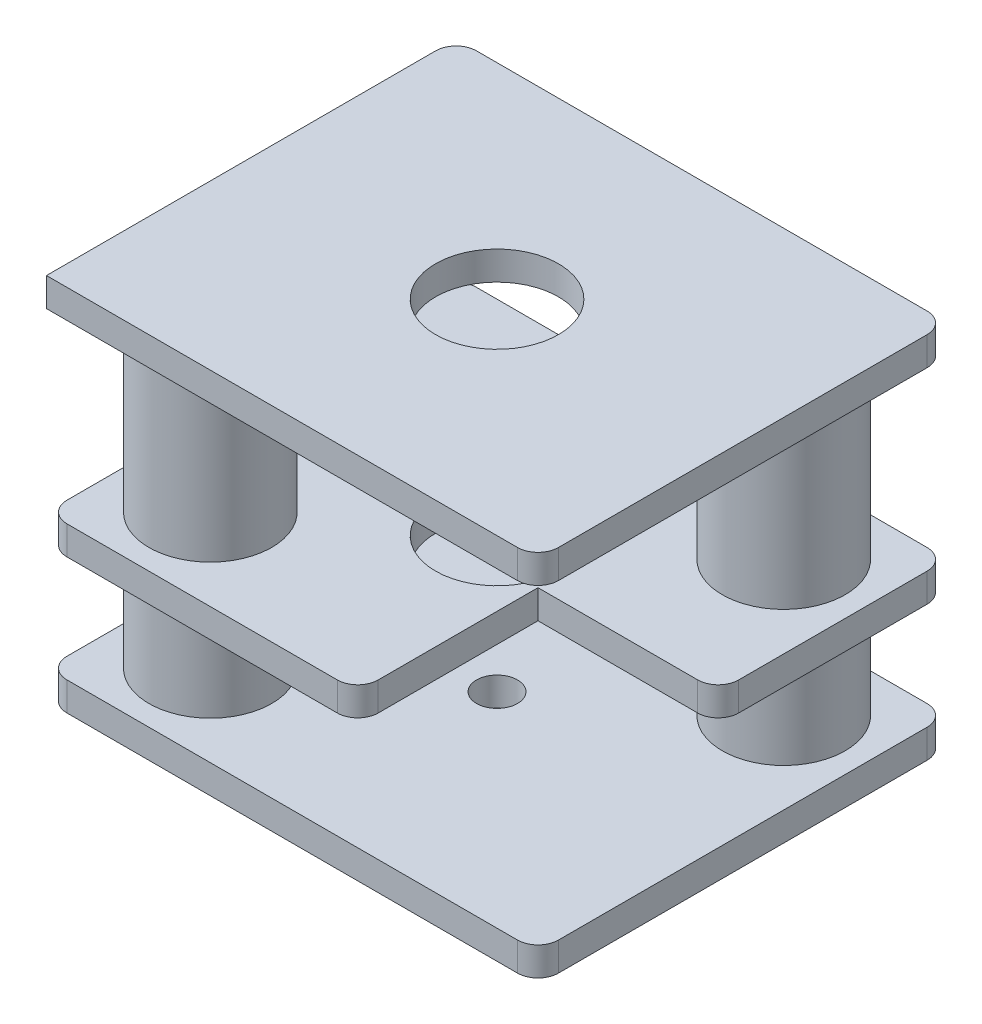
from build123d import *

# Parameters (mm, degrees)
CROQUIS1_W              = 12
CROQUIS1_H              = 10
CROQUIS1_R              = 0.5
SALIENTE_EXTRUIR1_DEPTH = 0.7
CROQUIS2_R              = 1.5
SALIENTE_EXTRUIR2_DEPTH = 8.3
SALIENTE_EXTRUIR3_DEPTH = 0.7
SALIENTE_EXTRUIR4_DEPTH = 0.7
CORTAR_EXTRUIR1_REACH   = 13.916
CROQUIS5_R              = 1.5
REDONDEO1_R             = 0.5


with BuildPart() as part:
    # Croquis1 → Saliente-Extruir1 (new body)
    with BuildSketch(Plane(origin=(0, 0, 0), x_dir=(1, 0, 0), z_dir=(0, 1, 0))):
        Rectangle(CROQUIS1_W, CROQUIS1_H)
        with Locations(Location((0, 0, 0), (0, 0, 270))):
            Circle(CROQUIS1_R, mode=Mode.SUBTRACT)
    extrude(amount=SALIENTE_EXTRUIR1_DEPTH)

    # Croquis2 → Saliente-Extruir2 (add)
    with BuildSketch(Plane(origin=(0, 0.7, 0), x_dir=(1, 0, 0), z_dir=(0, 1, 0))):
        with Locations(Location((4, 3, 0), (0, 0, 90))):
            Circle(CROQUIS2_R)
        with Locations(Location((-4, -3, 0), (0, 0, 90))):
            Circle(CROQUIS2_R)
    extrude(amount=SALIENTE_EXTRUIR2_DEPTH)

    # Croquis3 → Saliente-Extruir3 (add)
    with BuildSketch(Plane(origin=(0, 3.3, 0), x_dir=(1, 0, 0), z_dir=(0, 1, 0))):
        Polygon((6, -0.6), (1.6, -0.6), (1.6, -5), (-6, -5), (-6, 5), (6, 5), align=None)
    extrude(amount=SALIENTE_EXTRUIR3_DEPTH)

    # Croquis4 → Saliente-Extruir4 (add)
    with BuildSketch(Plane(origin=(0, 8.3, 0), x_dir=(1, 0, 0), z_dir=(0, 1, 0))):
        Polygon((6, -0.6), (6, -5), (1.6, -5), (-6, -5), (-6, 5), (6, 5), align=None)
    extrude(amount=SALIENTE_EXTRUIR4_DEPTH)

    # Cortar-Extruir1: up to this face of the body (flat: up to its plane)
    cortar_extruir1_end = Plane(part.part.faces().sort_by_distance((-0.850469255, 3.3, -0.626661556))[0])
    # Croquis5 → Cortar-Extruir1 (cut, up to the picked face)
    with BuildSketch(Plane(origin=(0, 9, 0), x_dir=(1, 0, 0), z_dir=(0, 1, 0)), mode=Mode.PRIVATE) as cortar_extruir1_sk1:
        with Locations(Location((0, 0, 0), (0, 0, 270))):
            Circle(CROQUIS5_R)
    cortar_extruir1_tool1 = split(extrude(cortar_extruir1_sk1.sketch, amount=-CORTAR_EXTRUIR1_REACH, mode=Mode.PRIVATE), bisect_by=cortar_extruir1_end, keep=Keep.BOTH, mode=Mode.PRIVATE)
    add(cortar_extruir1_tool1.solids().sort_by(Axis((0, 9, 0), (0, -1, 0)))[0], mode=Mode.SUBTRACT)

    # Redondeo1
    redondeo1_edges = [part.edges().sort_by_distance(p)[0] for p in [
        (6, 3.65, -5),
        (-6, 3.65, -5),
        (-6, 3.65, 5),
        (1.6, 3.65, 5),
        (6, 3.65, 0.6),
        (6, 8.65, -5),
        (-6, 8.65, -5),
        (6, 8.65, 5),
        (6, 0.35, 5),
        (-6, 0.35, 5),
        (-6, 0.35, -5),
        (6, 0.35, -5),
    ]]
    fillet(redondeo1_edges, radius=REDONDEO1_R)


solid = part.part
